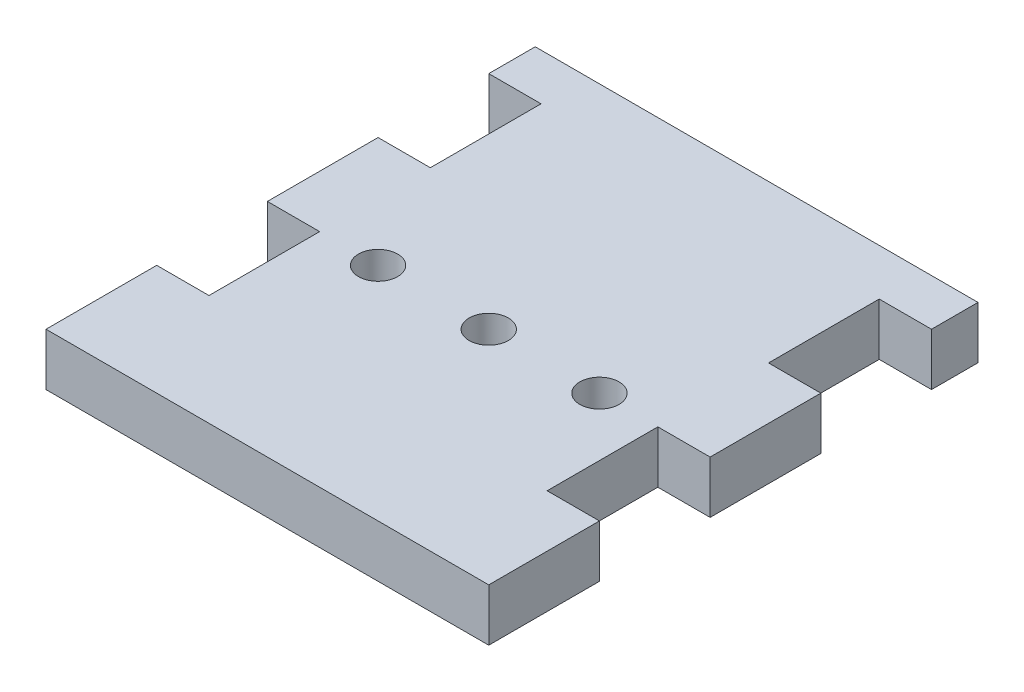
from build123d import *

# Parameters (mm, degrees)
SKETCH1_W            = 50.8
SKETCH1_H            = 56.134
MAIN_DEPTH           = 6
SKETCH2_W            = 6
SKETCH2_H            = 12.7
ACRYLIC_MOUNTS_DEPTH = 39.326446339
SKETCH3_R            = 2.2479
CUT_EXTRUDE1_DEPTH   = 39.326446339


with BuildPart() as part:
    # Sketch1 → Main (new body)
    with BuildSketch(Plane(origin=(0, 0, 0), x_dir=(1, 0, 0), z_dir=(0, 1, 0))):
        Rectangle(SKETCH1_W, SKETCH1_H)
    extrude(amount=MAIN_DEPTH)

    # Sketch2 → Acrylic Mounts (cut, through all)
    with BuildSketch(Plane(origin=(0, 6, 0), x_dir=(1, 0, 0), z_dir=(0, 1, 0))):
        with Locations((-22.4, -9.017)):
            Rectangle(SKETCH2_W, SKETCH2_H)
        with Locations((-22.4, 16.383)):
            Rectangle(SKETCH2_W, SKETCH2_H)
        with Locations((22.4, 16.383)):
            Rectangle(SKETCH2_W, SKETCH2_H)
        with Locations((22.4, -9.017)):
            Rectangle(SKETCH2_W, SKETCH2_H)
    extrude(amount=-ACRYLIC_MOUNTS_DEPTH, mode=Mode.SUBTRACT)

    # Sketch3 → Cut-Extrude1 (cut, through all)
    with BuildSketch(Plane(origin=(0, 0, 0), x_dir=(-1, 0, 0), z_dir=(0, -1, 0))):
        with Locations(Location((12.7, -2.667, 0), (0, 0, 90))):
            Circle(SKETCH3_R)
        with Locations(Location((-12.7, -2.667, 0), (0, 0, 90))):
            Circle(SKETCH3_R)
        with Locations(Location((0, -2.667, 0), (0, 0, 90))):
            Circle(SKETCH3_R)
    extrude(amount=-CUT_EXTRUDE1_DEPTH, mode=Mode.SUBTRACT)


solid = part.part
